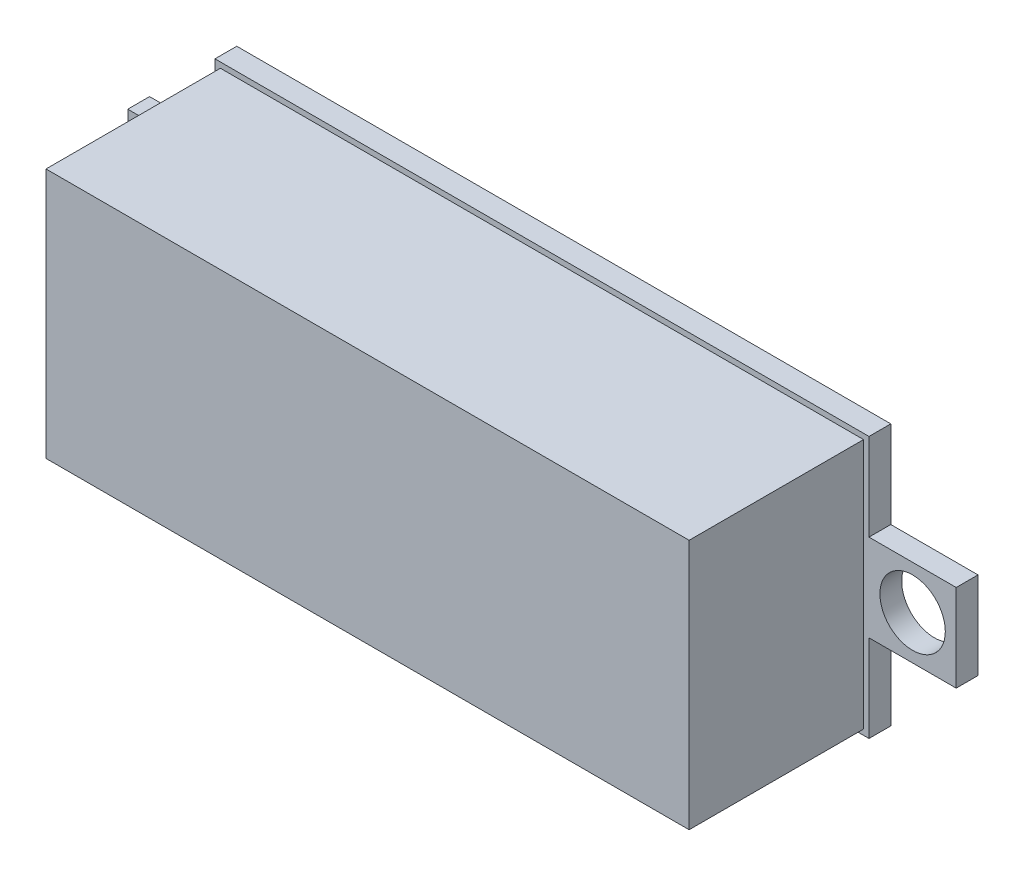
from build123d import *

# Parameters (mm, degrees)
SCHIZZO1_W                   = 4
SCHIZZO1_H                   = 4
SCHIZZO1_R                   = 1.5
SCHIZZO1_W_2                 = 30
SCHIZZO1_H_2                 = 12
ESTRUSIONE_ESTRUSIONE1_DEPTH = 1
SCHIZZO2_W                   = 29.5
SCHIZZO2_H                   = 11.5
ESTRUSIONE_ESTRUSIONE2_DEPTH = 8


with BuildPart() as part:
    # Schizzo1 → Estrusione-Estrusione1 (new body)
    # profile 1 of 3: a face of its own
    with BuildSketch(Plane.XY):
        with Locations((-2, 6)):
            Rectangle(SCHIZZO1_W, SCHIZZO1_H)
        with Locations((-2, 6)):
            Circle(SCHIZZO1_R, mode=Mode.SUBTRACT)
    # profile 2 of 3: a face of its own
    with BuildSketch(Plane.XY):
        with Locations((15, 6)):
            Rectangle(SCHIZZO1_W_2, SCHIZZO1_H_2)
    # profile 3 of 3: a face of its own
    with BuildSketch(Plane.XY):
        with Locations((32, 6)):
            Rectangle(SCHIZZO1_W, SCHIZZO1_H)
        with Locations((32, 6)):
            Circle(SCHIZZO1_R, mode=Mode.SUBTRACT)
    extrude(amount=ESTRUSIONE_ESTRUSIONE1_DEPTH)

    # Schizzo2 → Estrusione-Estrusione2 (add)
    with BuildSketch(Plane.XY.offset(1)):
        with Locations((15, 6)):
            Rectangle(SCHIZZO2_W, SCHIZZO2_H)
    extrude(amount=ESTRUSIONE_ESTRUSIONE2_DEPTH)


solid = part.part
